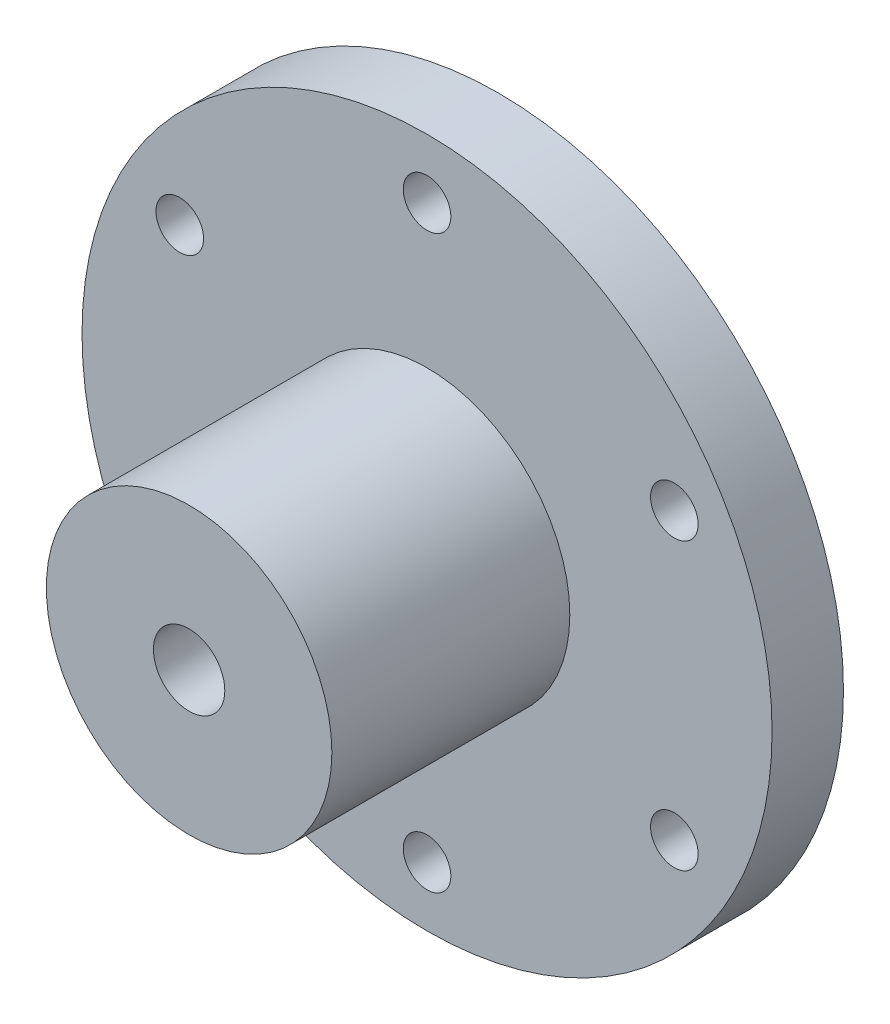
from build123d import *

# Parameters (mm, degrees)
SKETCH_1_R          = 29
EXTRUDE_1_DEPTH     = 6
SKETCH_2_R          = 12
EXTRUDE_2_DEPTH     = 20
SKETCH_3_R          = 2
CUT_EXTRUDE_1_DEPTH = 10
SKETCH_4_R          = 3
CUT_EXTRUDE_2_DEPTH = 30


with BuildPart() as part:
    # 草图1 → 凸台-拉伸1 (new body)
    with BuildSketch(Plane.XY):
        Circle(SKETCH_1_R)
    extrude(amount=EXTRUDE_1_DEPTH)

    # 草图2 → 凸台-拉伸2 (add)
    with BuildSketch(Plane.XY.offset(6)):
        Circle(SKETCH_2_R)
    extrude(amount=EXTRUDE_2_DEPTH)

    # 草图3 → 切除-拉伸1 (cut)
    with BuildSketch(Plane.XY.offset(6)):
        with Locations((0, 24)):
            Circle(SKETCH_3_R)
        with Locations((20.784609691, 12)):
            Circle(SKETCH_3_R)
        with Locations((20.784609691, -12)):
            Circle(SKETCH_3_R)
        with Locations((0, -24)):
            Circle(SKETCH_3_R)
        with Locations((-20.784609691, -12)):
            Circle(SKETCH_3_R)
        with Locations((-20.784609691, 12)):
            Circle(SKETCH_3_R)
    extrude(amount=-CUT_EXTRUDE_1_DEPTH, mode=Mode.SUBTRACT)

    # 草图4 → 切除-拉伸2 (cut)
    with BuildSketch(Plane.XY.offset(26)):
        Circle(SKETCH_4_R)
    extrude(amount=-CUT_EXTRUDE_2_DEPTH, mode=Mode.SUBTRACT)


solid = part.part
